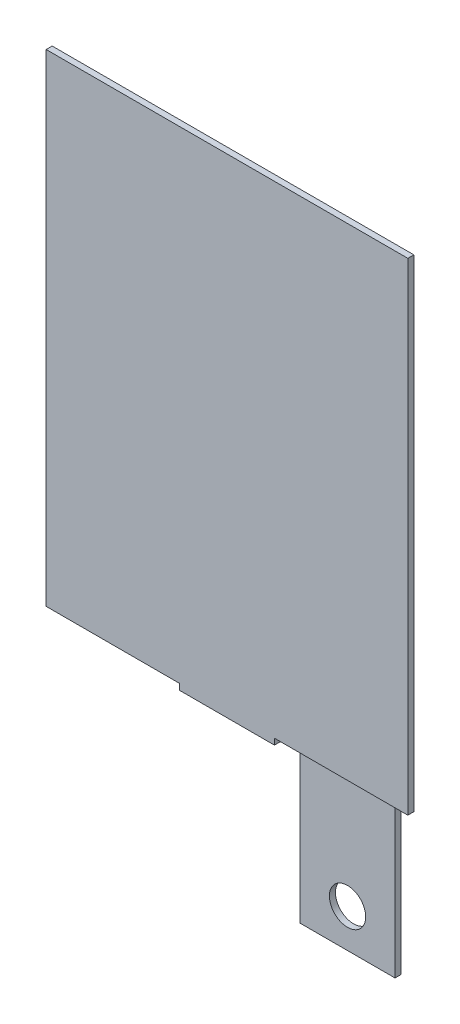
from build123d import *

# Parameters (mm, degrees)
SKETCH1_W           = 7.874
SKETCH1_H           = 22.225
SKETCH1_R           = 1.504480346
BOSS_EXTRUDE1_DEPTH = 0.5
SKETCH2_W           = 7.874
SKETCH2_H           = 0.5
BOSS_EXTRUDE2_DEPTH = 10
SKETCH3_W           = 30
SKETCH3_H           = 0.5
BOSS_EXTRUDE3_DEPTH = 40


with BuildPart() as part:
    # Sketch1 → Boss-Extrude1 (new body)
    with BuildSketch(Plane.XY):
        with Locations((0, 118.9355)):
            Rectangle(SKETCH1_W, SKETCH1_H)
        with Locations((0, 123.698)):
            Circle(SKETCH1_R, mode=Mode.SUBTRACT)
        with Locations((0, 110.998)):
            Circle(SKETCH1_R, mode=Mode.SUBTRACT)
    extrude(amount=BOSS_EXTRUDE1_DEPTH)

    # Sketch2 → Boss-Extrude2 (add)
    with BuildSketch(Plane.XY.offset(0.5)):
        with Locations((0, 129.798)):
            Rectangle(SKETCH2_W, SKETCH2_H)
    extrude(amount=BOSS_EXTRUDE2_DEPTH)

    # Sketch3 → Boss-Extrude3 (add)
    with BuildSketch(Plane(origin=(0, 130.048, 0), x_dir=(1, 0, 0), z_dir=(0, 1, 0))):
        with Locations((0, -10.25)):
            Rectangle(SKETCH3_W, SKETCH3_H)
    extrude(amount=BOSS_EXTRUDE3_DEPTH)


solid = part.part
